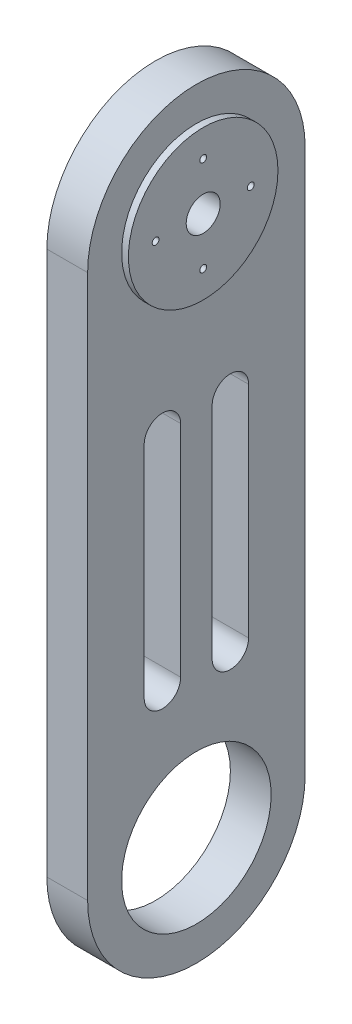
from build123d import *

# Parameters (mm, degrees)
BOSS_EXTRUDE1_DEPTH      = 3
BOSS_EXTRUDE1_DEPTH_BACK = 3
SKETCH1_R                = 11
BOSS_EXTRUDE2_DEPTH      = 4
BOSS_EXTRUDE2_DEPTH_BACK = 2
SKETCH1_2_R              = 11
CUT_EXTRUDE1_DEPTH       = 6
SKETCH3_R                = 2.5
SKETCH3_R_2              = 0.5
CUT_EXTRUDE2_DEPTH       = 6


with BuildPart() as part:
    # Sketch1 → Boss-Extrude1 (new, two sides: drawn at the far end of the back side and taken through both)
    with BuildSketch(Plane(origin=(0, 0, 0), x_dir=(0, 0, -1), z_dir=(1, 0, 0)).offset(-BOSS_EXTRUDE1_DEPTH_BACK)):
        with BuildLine():
            Line((-16, 0), (-16, -80))
            ThreePointArc((-16, -80), (0, -96), (16, -80))
            Line((16, -80), (16, 0))
            ThreePointArc((16, 0), (0, 16), (-16, 0))
        make_face()
        Circle(SKETCH1_R, mode=Mode.SUBTRACT)
        with Locations((0, -80)):
            Circle(SKETCH1_R, mode=Mode.SUBTRACT)
    extrude(amount=BOSS_EXTRUDE1_DEPTH + BOSS_EXTRUDE1_DEPTH_BACK)

    # Sketch1<2> → Boss-Extrude2 (add, two sides: drawn at the far end of the back side and taken through both)
    with BuildSketch(Plane(origin=(0, 0, 0), x_dir=(0, 0, -1), z_dir=(1, 0, 0)).offset(-BOSS_EXTRUDE2_DEPTH_BACK)):
        Circle(SKETCH1_2_R)
    extrude(amount=BOSS_EXTRUDE2_DEPTH + BOSS_EXTRUDE2_DEPTH_BACK)

    # Sketch2 → Cut-Extrude1 (cut)
    with BuildSketch(Plane(origin=(3, 0, 0), x_dir=(0, 0, -1), z_dir=(1, 0, 0))):
        with BuildLine():
            Line((-2.317597737, -26.071446828), (-2.317597737, -58.382201359))
            ThreePointArc((-2.317597737, -58.382201359), (-5, -61.064603622), (-7.682402263, -58.382201359))
            Line((-7.682402263, -58.382201359), (-7.682402263, -26.071446828))
            ThreePointArc((-7.682402263, -26.071446828), (-5, -23.389044565), (-2.317597737, -26.071446828))
        make_face()
        with BuildLine():
            Line((2.317597737, -26.071446828), (2.317597737, -58.382201359))
            ThreePointArc((2.317597737, -58.382201359), (5, -61.064603622), (7.682402263, -58.382201359))
            Line((7.682402263, -58.382201359), (7.682402263, -26.071446828))
            ThreePointArc((7.682402263, -26.071446828), (5, -23.389044565), (2.317597737, -26.071446828))
        make_face()
    extrude(amount=-CUT_EXTRUDE1_DEPTH, mode=Mode.SUBTRACT)

    # Sketch3 → Cut-Extrude2 (cut)
    with BuildSketch(Plane.ZY.offset(2)):
        Circle(SKETCH3_R)
        with Locations((0, 7)):
            Circle(SKETCH3_R_2)
        with Locations((-7, 0)):
            Circle(SKETCH3_R_2)
        with Locations((7, 0)):
            Circle(SKETCH3_R_2)
        with Locations((0, -7)):
            Circle(SKETCH3_R_2)
    extrude(amount=-CUT_EXTRUDE2_DEPTH, mode=Mode.SUBTRACT)


solid = part.part
